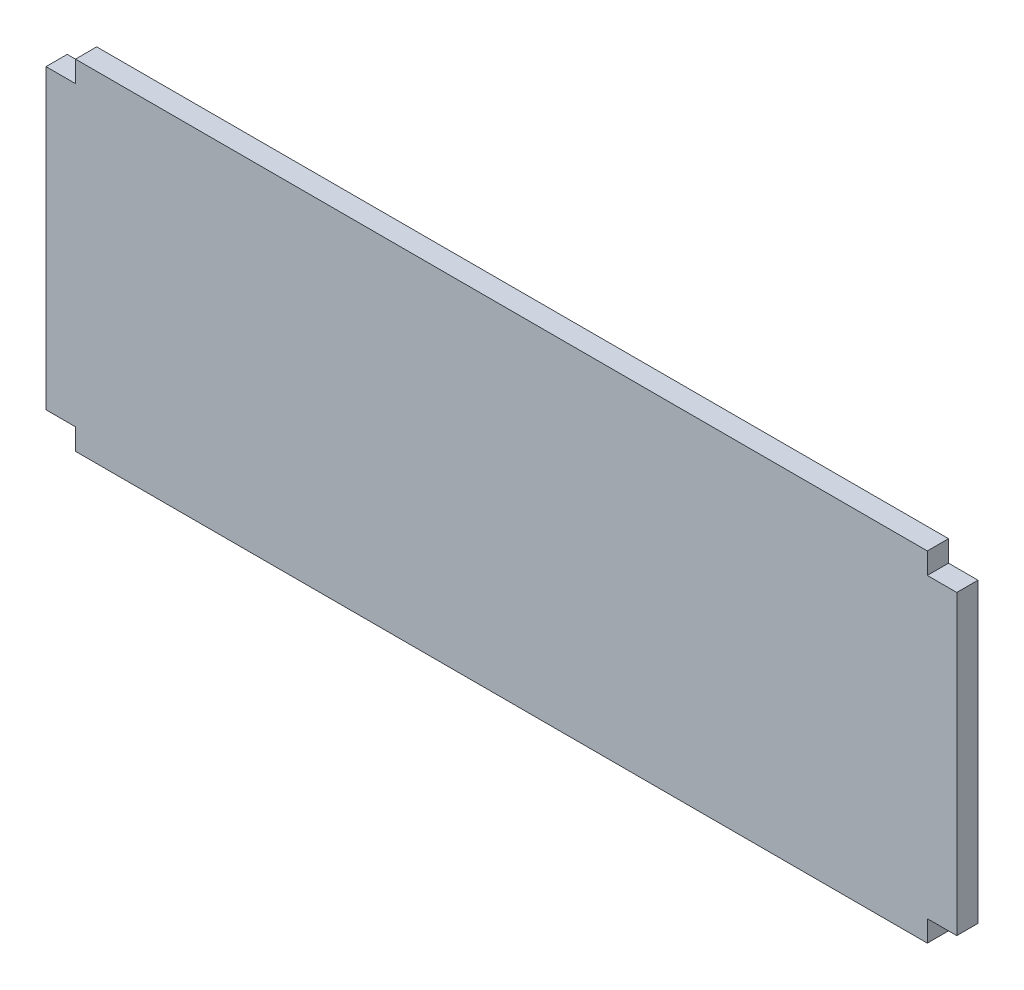
from build123d import *

# Parameters (mm, degrees)
BOSS_EXTRUDE1_DEPTH = 5.08


with BuildPart() as part:
    # Sketch1 → Boss-Extrude1 (new body)
    with BuildSketch(Plane.XY):
        Polygon((49.444236025, 115.911666867), (42.396310531, 115.911666867), (42.396310531, 44.791666867), (49.444236025, 44.791666867), (49.444236025, 39.711666867), (253.279004246, 39.711666867), (253.279004246, 44.791666867), (260.32692974, 44.791666867), (260.32692974, 115.911666867), (253.279004246, 115.911666867), (253.279004246, 120.991666867), (49.444236025, 120.991666867), align=None)
    extrude(amount=BOSS_EXTRUDE1_DEPTH)


solid = part.part
